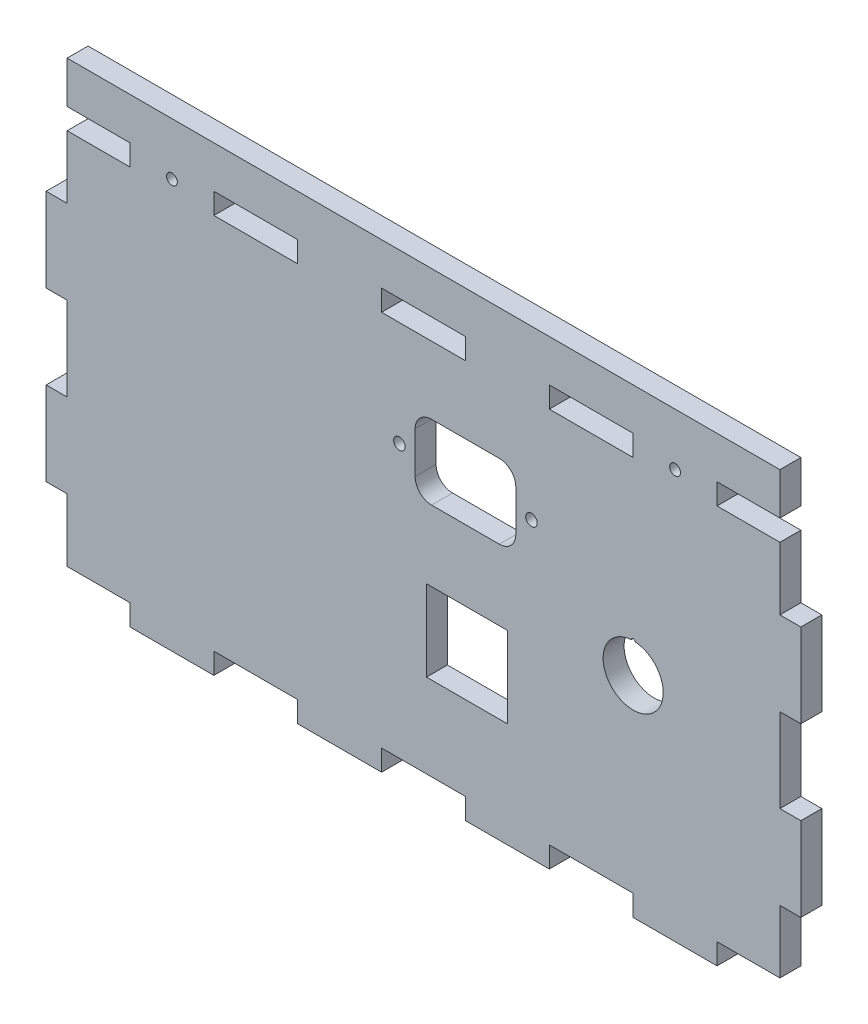
from build123d import *

# Parameters (mm, degrees)
SKETCH1_W                 = 228.6
SKETCH1_H                 = 139.7
BOSS_EXTRUDE1_DEPTH       = 6.35
SKETCH5_W                 = 6.35
SKETCH5_H                 = 25.4
CUT_EXTRUDE4_DEPTH        = 6.35
SKETCH6_W                 = 25.4
SKETCH6_H                 = 6.35
CUT_EXTRUDE5_DEPTH        = 6.35
LPATTERN5_COUNT           = 3
LPATTERN5_PITCH           = 50.8
LPATTERN5_COUNT_DIR2      = 2
LPATTERN5_PITCH_DIR2      = 222.25
LPATTERN6_COUNT           = 5
LPATTERN6_PITCH           = 50.8
LPATTERN6_COUNT_DIR2      = 2
LPATTERN6_PITCH_DIR2      = 120.65
SKETCH7_W                 = 6.35
SKETCH7_H                 = 19.05
CUT_EXTRUDE6_DEPTH        = 6.35
SKETCH8_W                 = 6.35
SKETCH8_H                 = 19.05
CUT_EXTRUDE7_DEPTH        = 6.35
F_4_CLEARANCE_HOLE1_D     = 3.2639
F_4_CLEARANCE_HOLE1_DEPTH = 10.16
F_4_CLEARANCE_HOLE1_TIP   = 0.980574487
SKETCH11_R                = 0.55
SKETCH11_R_2              = 9.1
CUT_EXTRUDE8_DEPTH        = 6.35
SKETCH12_R                = 1.75
CUT_EXTRUDE9_DEPTH        = 6.35
SKETCH13_W                = 24.5
SKETCH13_H                = 24.5
CUT_EXTRUDE10_DEPTH       = 6.35


with BuildPart() as part:
    # Sketch1 → Boss-Extrude1 (new body)
    with BuildSketch(Plane.XY):
        with Locations((114.3, 69.85)):
            Rectangle(SKETCH1_W, SKETCH1_H)
    extrude(amount=BOSS_EXTRUDE1_DEPTH)

    # Sketch5 → Cut-Extrude4 (cut)
    with BuildSketch(Plane.XY.offset(6.35)):
        with Locations((3.175, 12.7)):
            Rectangle(SKETCH5_W, SKETCH5_H)
    cut_extrude4 = extrude(amount=-CUT_EXTRUDE4_DEPTH, mode=Mode.SUBTRACT)

    # Sketch6 → Cut-Extrude5 (cut)
    with BuildSketch(Plane.XY.offset(6.35)):
        with Locations((12.7, 3.175)):
            Rectangle(SKETCH6_W, SKETCH6_H)
    cut_extrude5 = extrude(amount=-CUT_EXTRUDE5_DEPTH, mode=Mode.SUBTRACT)

    # LPattern5: Cut-Extrude4 3 × 2
    with Locations(*[(j * LPATTERN5_PITCH_DIR2, i * LPATTERN5_PITCH, 0) for i in range(LPATTERN5_COUNT) for j in range(LPATTERN5_COUNT_DIR2) if (i, j) != (0, 0)]):
        add(cut_extrude4, mode=Mode.SUBTRACT)

    # LPattern6: Cut-Extrude5 5 × 2
    with Locations(*[(i * LPATTERN6_PITCH, j * LPATTERN6_PITCH_DIR2, 0) for i in range(LPATTERN6_COUNT) for j in range(LPATTERN6_COUNT_DIR2) if (i, j) != (0, 0)]):
        add(cut_extrude5, mode=Mode.SUBTRACT)

    # Sketch7 → Cut-Extrude6 (cut)
    with BuildSketch(Plane.XY.offset(6.35)):
        with Locations((3.175, 130.175)):
            Rectangle(SKETCH7_W, SKETCH7_H)
    extrude(amount=-CUT_EXTRUDE6_DEPTH, mode=Mode.SUBTRACT)

    # Sketch8 → Cut-Extrude7 (cut)
    with BuildSketch(Plane.XY.offset(6.35)):
        with Locations((225.425, 130.175)):
            Rectangle(SKETCH8_W, SKETCH8_H)
    extrude(amount=-CUT_EXTRUDE7_DEPTH, mode=Mode.SUBTRACT)

    # #4 Clearance Hole1
    with Locations(Plane.XY.offset(6.35)):
        with Locations((38.1, 123.825), (190.5, 123.825)):
            Hole(F_4_CLEARANCE_HOLE1_D / 2, depth=F_4_CLEARANCE_HOLE1_DEPTH)
            with Locations((0, 0, -(F_4_CLEARANCE_HOLE1_DEPTH + F_4_CLEARANCE_HOLE1_TIP / 2))):  # 118° drill point
                Cone(0, F_4_CLEARANCE_HOLE1_D / 2, F_4_CLEARANCE_HOLE1_TIP, mode=Mode.SUBTRACT)

    # Sketch11 → Cut-Extrude8 (cut)
    with BuildSketch(Plane.XY.offset(6.35)):
        with Locations((177.8, 72.6)):
            Circle(SKETCH11_R)
        with Locations((177.8, 63.5)):
            Circle(SKETCH11_R_2)
    extrude(amount=-CUT_EXTRUDE8_DEPTH, mode=Mode.SUBTRACT)

    # Sketch12 → Cut-Extrude9 (cut)
    with BuildSketch(Plane.XY.offset(6.35)):
        with Locations((107, 88.9)):
            Circle(SKETCH12_R)
        with Locations((147, 88.9)):
            Circle(SKETCH12_R)
        with BuildLine():
            Line((116.75, 100.15), (137.25, 100.15))
            ThreePointArc((137.25, 100.15), (140.785533906, 98.685533906), (142.25, 95.15))
            Line((142.25, 95.15), (142.25, 82.65))
            ThreePointArc((142.25, 82.65), (140.785533906, 79.114466094), (137.25, 77.65))
            Line((137.25, 77.65), (116.75, 77.65))
            ThreePointArc((116.75, 77.65), (113.214466094, 79.114466094), (111.75, 82.65))
            Line((111.75, 82.65), (111.75, 95.15))
            ThreePointArc((111.75, 95.15), (113.214466094, 98.685533906), (116.75, 100.15))
        make_face()
    extrude(amount=-CUT_EXTRUDE9_DEPTH, mode=Mode.SUBTRACT)

    # Sketch13 → Cut-Extrude10 (cut)
    with BuildSketch(Plane.XY.offset(6.35)):
        with Locations((127.45, 44)):
            Rectangle(SKETCH13_W, SKETCH13_H)
    extrude(amount=-CUT_EXTRUDE10_DEPTH, mode=Mode.SUBTRACT)


solid = part.part
